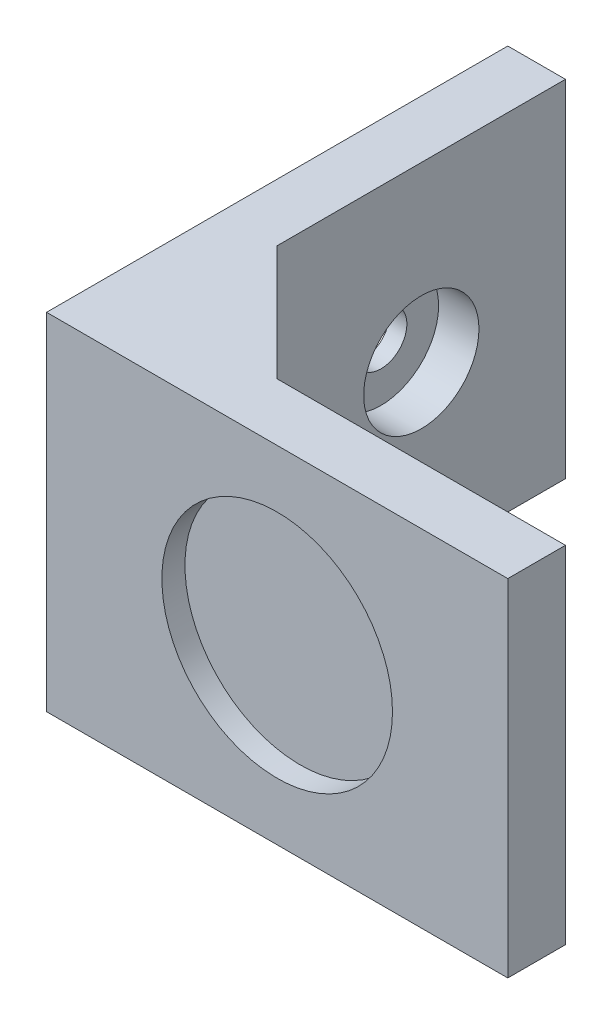
from build123d import *

# Parameters (mm, degrees)
ESTRUSIONE_ESTRUSIONE2_DEPTH                         = 30
FORO_LAMATO_PER_VITE_M4_A_TESTA_CILINDRI_D           = 4.5
FORO_LAMATO_PER_VITE_M4_A_TESTA_CILINDRI_DEPTH       = 15
FORO_LAMATO_PER_VITE_M4_A_TESTA_CILINDRI_CBORE_D     = 10
FORO_LAMATO_PER_VITE_M4_A_TESTA_CILINDRI_CBORE_DEPTH = 3.5
FORO_LAMATO_PER_VITE_M4_A_TESTA_CILINDRI_TIP         = 1.351936393
SCHIZZO6_R                                           = 10
TAGLIO_ESTRUSIONE1_DEPTH                             = 2


with BuildPart() as part:
    # Schizzo2 → Estrusione-Estrusione2 (new body)
    with BuildSketch(Plane(origin=(0, 0, 0), x_dir=(1, 0, 0), z_dir=(0, 1, 0))):
        Polygon((0, 25), (0, 0), (10, -10), (35, -10), (35, -15), (-5, -15), (-5, 25), align=None)
    extrude(amount=ESTRUSIONE_ESTRUSIONE2_DEPTH)

    # Foro lamato per Vite M4 a testa cilindrica piana-1
    with Locations(Plane(origin=(0, 0, 0), x_dir=(0, 0, -1), z_dir=(1, 0, 0))):
        with Locations((12.5, 15)):
            CounterBoreHole(FORO_LAMATO_PER_VITE_M4_A_TESTA_CILINDRI_D / 2, FORO_LAMATO_PER_VITE_M4_A_TESTA_CILINDRI_CBORE_D / 2, FORO_LAMATO_PER_VITE_M4_A_TESTA_CILINDRI_CBORE_DEPTH, depth=FORO_LAMATO_PER_VITE_M4_A_TESTA_CILINDRI_DEPTH)
            with Locations((0, 0, -(FORO_LAMATO_PER_VITE_M4_A_TESTA_CILINDRI_DEPTH + FORO_LAMATO_PER_VITE_M4_A_TESTA_CILINDRI_TIP / 2))):  # 118° drill point
                Cone(0, FORO_LAMATO_PER_VITE_M4_A_TESTA_CILINDRI_D / 2, FORO_LAMATO_PER_VITE_M4_A_TESTA_CILINDRI_TIP, mode=Mode.SUBTRACT)

    # Schizzo6 → Taglio-Estrusione1 (cut)
    with BuildSketch(Plane.XY.offset(15)):
        with Locations((15, 15)):
            Circle(SCHIZZO6_R)
    extrude(amount=-TAGLIO_ESTRUSIONE1_DEPTH, mode=Mode.SUBTRACT)


solid = part.part
